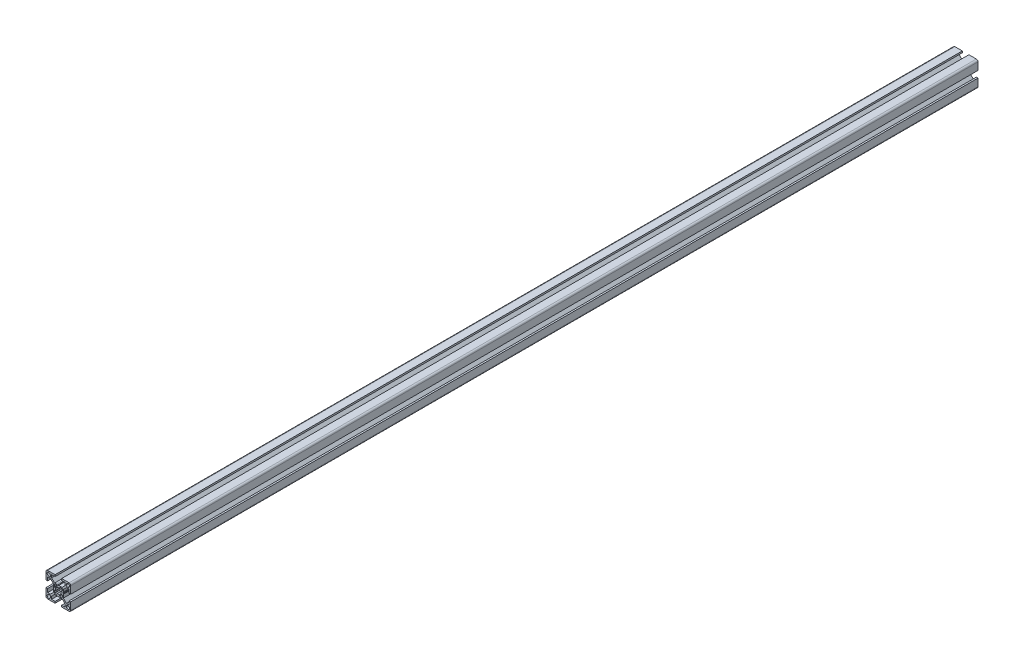
from build123d import *

# Parameters (mm, degrees)
BOSS_EXTRUDE1_DEPTH = 1100
CUT_EXTRUDE1_DEPTH  = 1101.20452644


with BuildPart() as part:
    # Sketch1 → Boss-Extrude1 (new body)
    with BuildSketch(Plane.XY):
        with BuildLine():
            Line((-15, 4), (-13, 4))
            Line((-13, 4), (-13, 8.25))
            Line((-13, 8.25), (-9.664213562, 8.25))
            Line((-9.664213562, 8.25), (-6, 4.585786438))
            Line((-6, 4.585786438), (-6, 0.519615242))
            Line((-6, 0.519615242), (-5.7, 0))
            Line((-5.7, 0), (-5.933012702, -0.403589838))
            ThreePointArc((-5.933012702, -0.403589838), (-6, -0.653589838), (-5.933012702, -0.903589838))
            Line((-5.933012702, -0.903589838), (-5.750976592, -1.218885629))
            Line((-5.750976592, -1.218885629), (-6, -2.5))
            Line((-6, -2.5), (-6, -4.585786438))
            Line((-6, -4.585786438), (-9.664213562, -8.25))
            Line((-9.664213562, -8.25), (-13, -8.25))
            Line((-13, -8.25), (-13, -4))
            Line((-13, -4), (-15, -4))
            Line((-15, -4), (-15, -13))
            ThreePointArc((-15, -13), (-14.414213562, -14.414213562), (-13, -15))
            Line((-13, -15), (-4, -15))
            Line((-4, -15), (-4, -13))
            Line((-4, -13), (-8.25, -13))
            Line((-8.25, -13), (-8.25, -9.664213562))
            Line((-8.25, -9.664213562), (-4.585786438, -6))
            Line((-4.585786438, -6), (-0.519615242, -6))
            Line((-0.519615242, -6), (0, -5.7))
            Line((0, -5.7), (0.403589838, -5.933012702))
            ThreePointArc((0.403589838, -5.933012702), (0.653589838, -6), (0.903589838, -5.933012702))
            Line((0.903589838, -5.933012702), (1.218885629, -5.750976592))
            Line((1.218885629, -5.750976592), (2.5, -6))
            Line((2.5, -6), (4.585786438, -6))
            Line((4.585786438, -6), (8.25, -9.664213562))
            Line((8.25, -9.664213562), (8.25, -13))
            Line((8.25, -13), (4, -13))
            Line((4, -13), (4, -15))
            Line((4, -15), (13, -15))
            ThreePointArc((13, -15), (14.414213562, -14.414213562), (15, -13))
            Line((15, -13), (15, -4))
            Line((15, -4), (13, -4))
            Line((13, -4), (13, -8.25))
            Line((13, -8.25), (9.664213562, -8.25))
            Line((9.664213562, -8.25), (6, -4.585786438))
            Line((6, -4.585786438), (6, -0.519615242))
            Line((6, -0.519615242), (5.7, 0))
            Line((5.7, 0), (5.933012702, 0.403589838))
            ThreePointArc((5.933012702, 0.403589838), (6, 0.653589838), (5.933012702, 0.903589838))
            Line((5.933012702, 0.903589838), (5.750976592, 1.218885629))
            Line((5.750976592, 1.218885629), (6, 2.5))
            Line((6, 2.5), (6, 4.585786438))
            Line((6, 4.585786438), (9.664213562, 8.25))
            Line((9.664213562, 8.25), (13, 8.25))
            Line((13, 8.25), (13, 4))
            Line((13, 4), (15, 4))
            Line((15, 4), (15, 13))
            ThreePointArc((15, 13), (14.414213562, 14.414213562), (13, 15))
            Line((13, 15), (4, 15))
            Line((4, 15), (4, 13))
            Line((4, 13), (8.25, 13))
            Line((8.25, 13), (8.25, 9.664213562))
            Line((8.25, 9.664213562), (4.585786438, 6))
            Line((4.585786438, 6), (0.519615242, 6))
            Line((0.519615242, 6), (0, 5.7))
            Line((0, 5.7), (-0.403589838, 5.933012702))
            ThreePointArc((-0.403589838, 5.933012702), (-0.653589838, 6), (-0.903589838, 5.933012702))
            Line((-0.903589838, 5.933012702), (-1.218885629, 5.750976592))
            Line((-1.218885629, 5.750976592), (-2.5, 6))
            Line((-2.5, 6), (-4.585786438, 6))
            Line((-4.585786438, 6), (-8.25, 9.664213562))
            Line((-8.25, 9.664213562), (-8.25, 13))
            Line((-8.25, 13), (-4, 13))
            Line((-4, 13), (-4, 15))
            Line((-4, 15), (-13, 15))
            ThreePointArc((-13, 15), (-14.414213562, 14.414213562), (-15, 13))
            Line((-15, 13), (-15, 4))
        make_face()
        with BuildLine():
            Line((11.338915743, 9.539070071), (12.361530981, 9.918883282))
            ThreePointArc((12.361530981, 9.918883282), (13.043502884, 13.043502884), (9.918883282, 12.361530981))
            Line((9.918883282, 12.361530981), (9.539070071, 11.338915743))
            ThreePointArc((9.539070071, 11.338915743), (9.861522369, 9.861522369), (11.338915743, 9.539070071))
        make_face(mode=Mode.SUBTRACT)
        with BuildLine():
            Line((9.539070071, -11.338915743), (9.918883282, -12.361530981))
            ThreePointArc((9.918883282, -12.361530981), (13.043502884, -13.043502884), (12.361530981, -9.918883282))
            Line((12.361530981, -9.918883282), (11.338915743, -9.539070071))
            ThreePointArc((11.338915743, -9.539070071), (9.861522369, -9.861522369), (9.539070071, -11.338915743))
        make_face(mode=Mode.SUBTRACT)
        with BuildLine():
            Line((-12.361530981, 9.918883282), (-11.338915743, 9.539070071))
            ThreePointArc((-11.338915743, 9.539070071), (-9.861522369, 9.861522369), (-9.539070071, 11.338915743))
            Line((-9.539070071, 11.338915743), (-9.918883282, 12.361530981))
            ThreePointArc((-9.918883282, 12.361530981), (-13.043502884, 13.043502884), (-12.361530981, 9.918883282))
        make_face(mode=Mode.SUBTRACT)
        with BuildLine():
            Line((-9.918883282, -12.361530981), (-9.539070071, -11.338915743))
            ThreePointArc((-9.539070071, -11.338915743), (-9.861522369, -9.861522369), (-11.338915743, -9.539070071))
            Line((-11.338915743, -9.539070071), (-12.361530981, -9.918883282))
            ThreePointArc((-12.361530981, -9.918883282), (-13.043502884, -13.043502884), (-9.918883282, -12.361530981))
        make_face(mode=Mode.SUBTRACT)
    extrude(amount=-BOSS_EXTRUDE1_DEPTH)

    # Sketch2 → Cut-Extrude1 (cut, through all)
    with BuildSketch(Plane.XY):
        with BuildLine():
            Line((-4.5, -4.8), (-2.644433572, -4.8))
            ThreePointArc((-2.644433572, -4.8), (-2.615679847, -4.79861886), (-2.587190874, -4.794488155))
            Line((-2.587190874, -4.794488155), (-1.742757301, -4.630346896))
            ThreePointArc((-1.742757301, -4.630346896), (-1.568512625, -4.526682207), (-1.5, -4.335858741))
            Line((-1.5, -4.335858741), (-1.5, -3.5))
            ThreePointArc((-1.5, -3.5), (-1.374371466, -3.255879964), (-1.10270272, -3.21621621))
            ThreePointArc((-1.10270272, -3.21621621), (-9e-09, -3.4), (1.102702703, -3.216216216))
            ThreePointArc((1.102702703, -3.216216216), (1.374371458, -3.255879959), (1.5, -3.5))
            Line((1.5, -3.5), (1.5, -4.335858741))
            ThreePointArc((1.5, -4.335858741), (1.568512625, -4.526682207), (1.742757301, -4.630346896))
            Line((1.742757301, -4.630346896), (2.587190874, -4.794488155))
            ThreePointArc((2.587190874, -4.794488155), (2.615679847, -4.79861886), (2.644433572, -4.8))
            Line((2.644433572, -4.8), (4.5, -4.8))
            ThreePointArc((4.5, -4.8), (4.712132034, -4.712132034), (4.8, -4.5))
            Line((4.8, -4.5), (4.8, -2.644433572))
            ThreePointArc((4.8, -2.644433572), (4.79861886, -2.615679847), (4.794488155, -2.587190874))
            Line((4.794488155, -2.587190874), (4.630346896, -1.742757301))
            ThreePointArc((4.630346896, -1.742757301), (4.526682207, -1.568512625), (4.335858741, -1.5))
            Line((4.335858741, -1.5), (3.5, -1.5))
            ThreePointArc((3.5, -1.5), (3.255879964, -1.374371466), (3.21621621, -1.10270272))
            ThreePointArc((3.21621621, -1.10270272), (3.4, -9e-09), (3.216216216, 1.102702703))
            ThreePointArc((3.216216216, 1.102702703), (3.255879959, 1.374371458), (3.5, 1.5))
            Line((3.5, 1.5), (4.335858741, 1.5))
            ThreePointArc((4.335858741, 1.5), (4.526682207, 1.568512625), (4.630346896, 1.742757301))
            Line((4.630346896, 1.742757301), (4.794488155, 2.587190874))
            ThreePointArc((4.794488155, 2.587190874), (4.79861886, 2.615679847), (4.8, 2.644433572))
            Line((4.8, 2.644433572), (4.8, 4.5))
            ThreePointArc((4.8, 4.5), (4.712132034, 4.712132034), (4.5, 4.8))
            Line((4.5, 4.8), (2.644433572, 4.8))
            ThreePointArc((2.644433572, 4.8), (2.615679847, 4.79861886), (2.587190874, 4.794488155))
            Line((2.587190874, 4.794488155), (1.742757301, 4.630346896))
            ThreePointArc((1.742757301, 4.630346896), (1.568512625, 4.526682207), (1.5, 4.335858741))
            Line((1.5, 4.335858741), (1.5, 3.5))
            ThreePointArc((1.5, 3.5), (1.374371466, 3.255879964), (1.10270272, 3.21621621))
            ThreePointArc((1.10270272, 3.21621621), (9e-09, 3.4), (-1.102702703, 3.216216216))
            ThreePointArc((-1.102702703, 3.216216216), (-1.374371458, 3.255879959), (-1.5, 3.5))
            Line((-1.5, 3.5), (-1.5, 4.335858741))
            ThreePointArc((-1.5, 4.335858741), (-1.568512625, 4.526682207), (-1.742757301, 4.630346896))
            Line((-1.742757301, 4.630346896), (-2.587190874, 4.794488155))
            ThreePointArc((-2.587190874, 4.794488155), (-2.615679847, 4.79861886), (-2.644433572, 4.8))
            Line((-2.644433572, 4.8), (-4.5, 4.8))
            ThreePointArc((-4.5, 4.8), (-4.712132034, 4.712132034), (-4.8, 4.5))
            Line((-4.8, 4.5), (-4.8, 2.644433572))
            ThreePointArc((-4.8, 2.644433572), (-4.79861886, 2.615679847), (-4.794488155, 2.587190874))
            Line((-4.794488155, 2.587190874), (-4.630346896, 1.742757301))
            ThreePointArc((-4.630346896, 1.742757301), (-4.526682207, 1.568512625), (-4.335858741, 1.5))
            Line((-4.335858741, 1.5), (-3.5, 1.5))
            ThreePointArc((-3.5, 1.5), (-3.255879964, 1.374371466), (-3.21621621, 1.10270272))
            ThreePointArc((-3.21621621, 1.10270272), (-3.4, 9e-09), (-3.216216216, -1.102702703))
            ThreePointArc((-3.216216216, -1.102702703), (-3.255879959, -1.374371458), (-3.5, -1.5))
            Line((-3.5, -1.5), (-4.335858741, -1.5))
            ThreePointArc((-4.335858741, -1.5), (-4.526682207, -1.568512625), (-4.630346896, -1.742757301))
            Line((-4.630346896, -1.742757301), (-4.794488155, -2.587190874))
            ThreePointArc((-4.794488155, -2.587190874), (-4.79861886, -2.615679847), (-4.8, -2.644433572))
            Line((-4.8, -2.644433572), (-4.8, -4.5))
            ThreePointArc((-4.8, -4.5), (-4.712132034, -4.712132034), (-4.5, -4.8))
        make_face()
    extrude(amount=-CUT_EXTRUDE1_DEPTH, mode=Mode.SUBTRACT)


solid = part.part
